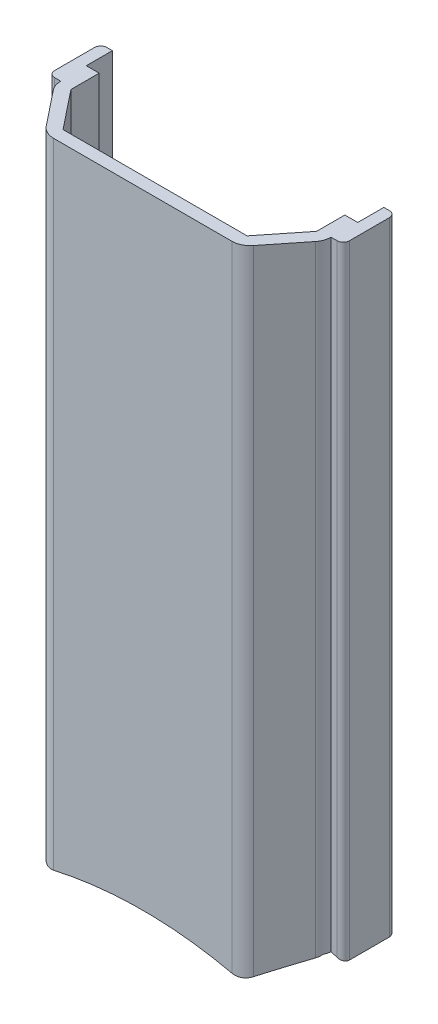
from build123d import *

# Parameters (mm, degrees)
EXTRUDE_1_DEPTH     = 58.89737674
EXTRUDE_START       = 38.399597665
EXTRUDE_2_DEPTH     = 38.399597665
EXTRUDE_3_REACH     = 66.893
SKETCH_3_W          = 44.2
SKETCH_3_H          = 3
EXTRUDE_4_REACH     = 66.893
SKETCH_4_W          = 44.2
SKETCH_4_H          = 3
CUT_EXTRUDE_START   = -77.29697691
CUT_EXTRUDE_1_DEPTH = 77.29697691
SKETCH_6_W          = 10.588620777
SKETCH_6_H          = 6.5
CUT_EXTRUDE_2_DEPTH = 3
EXTRUDE_START_2     = 15
EXTRUDE_5_DEPTH     = 15


with BuildPart() as part:
    # 草图1 → 凸台-拉伸1 (new body)
    with BuildSketch(Plane(origin=(0, 0, 0), x_dir=(1, 0, 0), z_dir=(0, 1, 0))):
        with BuildLine():
            Line((21.346642729, -10.719560241), (16.852020459, -16.362765964))
            ThreePointArc((16.852020459, -16.362765964), (15.807857901, -17.196247295), (14.505374257, -17.493741725))
            Line((14.505374257, -17.493741725), (-14.505381202, -17.493741725))
            ThreePointArc((-14.505381202, -17.493741725), (-15.807864846, -17.196247295), (-16.852027404, -16.362765964))
            Line((-16.852027404, -16.362765964), (-21.346649674, -10.719560241))
            ThreePointArc((-21.346649674, -10.719560241), (-21.831958504, -9.840501001), (-22.000003473, -8.850536003))
            Line((-22.000003473, -8.850536003), (-23.000003473, -8.850536003))
            ThreePointArc((-23.000003473, -8.850536003), (-23.707110254, -8.557642784), (-24.000003473, -7.850536003))
            Line((-24.000003473, -7.850536003), (-24.000003473, -1.349569462))
            ThreePointArc((-24.000003473, -1.349569462), (-23.707110254, -0.642462681), (-23.000003473, -0.349569462))
            Line((-23.000003473, -0.349569462), (-22.100003473, -0.349569462))
            Line((-22.100003473, -0.349569462), (-22.100003473, -4.600052733))
            Line((-22.100003473, -4.600052733), (-22.000003473, -4.600052733))
            Line((-22.000003473, -4.600052733), (-20.000003473, -4.600052733))
            Line((-20.000003473, -4.600052733), (-20.000003473, -9.200105465))
            Line((-20.000003473, -9.200105465), (-14.987335304, -15.493741725))
            Line((-14.987335304, -15.493741725), (14.987328359, -15.493741725))
            Line((14.987328359, -15.493741725), (19.999996527, -9.200105465))
            Line((19.999996527, -9.200105465), (19.999996527, -4.600052733))
            Line((19.999996527, -4.600052733), (21.999996527, -4.600052733))
            Line((21.999996527, -4.600052733), (22.099996527, -4.600052733))
            Line((22.099996527, -4.600052733), (22.099996527, -0.349569462))
            Line((22.099996527, -0.349569462), (22.999996527, -0.349569462))
            ThreePointArc((22.999996527, -0.349569462), (23.707103309, -0.642462681), (23.999996527, -1.349569462))
            Line((23.999996527, -1.349569462), (23.999996527, -7.850536003))
            ThreePointArc((23.999996527, -7.850536003), (23.707103309, -8.557642784), (22.999996527, -8.850536003))
            Line((22.999996527, -8.850536003), (21.999996527, -8.850536003))
            ThreePointArc((21.999996527, -8.850536003), (21.831951559, -9.840501001), (21.346642729, -10.719560241))
        make_face()
    extrude(amount=EXTRUDE_1_DEPTH)

    # 草图2 → 凸台-拉伸2 (add)
    with BuildSketch(Plane.XZ.offset(EXTRUDE_START)):
        with BuildLine():
            Line((22.999996527, 8.850536003), (21.999996527, 8.850536003))
            ThreePointArc((21.999996527, 8.850536003), (21.831951559, 9.840501001), (21.346642729, 10.719560241))
            Line((21.346642729, 10.719560241), (16.852020459, 16.362765964))
            ThreePointArc((16.852020459, 16.362765964), (15.807857901, 17.196247295), (14.505374257, 17.493741725))
            Line((14.505374257, 17.493741725), (-14.505381202, 17.493741725))
            ThreePointArc((-14.505381202, 17.493741725), (-15.807864846, 17.196247295), (-16.852027404, 16.362765964))
            Line((-16.852027404, 16.362765964), (-21.346649674, 10.719560241))
            ThreePointArc((-21.346649674, 10.719560241), (-21.831958504, 9.840501001), (-22.000003473, 8.850536003))
            Line((-22.000003473, 8.850536003), (-23.000003473, 8.850536003))
            ThreePointArc((-23.000003473, 8.850536003), (-23.707110254, 8.557642784), (-24.000003473, 7.850536003))
            Line((-24.000003473, 7.850536003), (-24.000003473, 1.349569462))
            ThreePointArc((-24.000003473, 1.349569462), (-23.707110254, 0.642462681), (-23.000003473, 0.349569462))
            Line((-23.000003473, 0.349569462), (-22.100003473, 0.349569462))
            Line((-22.100003473, 0.349569462), (-22.100003473, 4.600052733))
            Line((-22.100003473, 4.600052733), (-20.000003473, 4.600052733))
            Line((-20.000003473, 4.600052733), (-20.000003473, 9.200105465))
            Line((-20.000003473, 9.200105465), (-14.987335304, 15.493741725))
            Line((-14.987335304, 15.493741725), (14.987328359, 15.493741725))
            Line((14.987328359, 15.493741725), (19.999996527, 9.200105465))
            Line((19.999996527, 9.200105465), (19.999996527, 4.600052733))
            Line((19.999996527, 4.600052733), (22.099996527, 4.600052733))
            Line((22.099996527, 4.600052733), (22.099996527, 0.349569462))
            Line((22.099996527, 0.349569462), (22.999996527, 0.349569462))
            ThreePointArc((22.999996527, 0.349569462), (23.707103309, 0.642462681), (23.999996527, 1.349569462))
            Line((23.999996527, 1.349569462), (23.999996527, 7.850536003))
            ThreePointArc((23.999996527, 7.850536003), (23.707103309, 8.557642784), (22.999996527, 8.850536003))
        make_face()
    extrude(amount=-EXTRUDE_2_DEPTH)

    # 凸台-拉伸3: up to this face of the body (flat: up to its plane)
    extrude_3_end = Plane(part.part.faces().sort_by_distance((-3.473e-06, 10.248889538, 17.493741725))[0])
    # 草图3 → 凸台-拉伸3 (add, up to the picked face)
    with BuildSketch(Plane(origin=(0, 0, 4.600052733), x_dir=(-1, 0, 0), z_dir=(0, 0, -1)), mode=Mode.PRIVATE) as extrude_3_sk1:
        with Locations((3.473e-06, -36.899597665)):
            Rectangle(SKETCH_3_W, SKETCH_3_H)
    extrude_3_tool1 = split(extrude(extrude_3_sk1.sketch, amount=-EXTRUDE_3_REACH, mode=Mode.PRIVATE), bisect_by=extrude_3_end, keep=Keep.BOTH, mode=Mode.PRIVATE)
    add(extrude_3_tool1.solids().sort_by(Axis((-3e-06, -36.899598, 4.600053), (0, 0, 1)))[0])

    # 凸台-拉伸4: up to this face of the body (flat: up to its plane)
    extrude_4_end = Plane(part.part.faces().sort_by_distance((-3.473e-06, 9.499837909, 17.493741725))[0])
    # 草图4 → 凸台-拉伸4 (add, up to the picked face)
    with BuildSketch(Plane(origin=(0, 0, 4.600052733), x_dir=(-1, 0, 0), z_dir=(0, 0, -1)), mode=Mode.PRIVATE) as extrude_4_sk1:
        with Locations((3.473e-06, 37.397379245)):
            Rectangle(SKETCH_4_W, SKETCH_4_H)
    extrude_4_tool1 = split(extrude(extrude_4_sk1.sketch, amount=-EXTRUDE_4_REACH, mode=Mode.PRIVATE), bisect_by=extrude_4_end, keep=Keep.BOTH, mode=Mode.PRIVATE)
    add(extrude_4_tool1.solids().sort_by(Axis((-3e-06, 37.397379, 4.600053), (0, 0, 1)))[0])

    # 草图5 → 切除-拉伸1 (cut)
    with BuildSketch(Plane(origin=(0, 38.897379245, 0), x_dir=(1, 0, 0), z_dir=(0, 1, 0)).offset(CUT_EXTRUDE_START)):
        with BuildLine():
            Line((-22.100003473, -8.850536003), (-22.100003473, -17.493741725))
            Line((-22.100003473, -17.493741725), (-14.505381202, -17.493741725))
            ThreePointArc((-14.505381202, -17.493741725), (-15.807864846, -17.196247295), (-16.852027404, -16.362765964))
            Line((-16.852027404, -16.362765964), (-21.346649674, -10.719560241))
            ThreePointArc((-21.346649674, -10.719560241), (-21.831958504, -9.840501001), (-22.000003473, -8.850536003))
            Line((-22.000003473, -8.850536003), (-22.100003473, -8.850536003))
        make_face()
        with BuildLine():
            Line((14.505374257, -17.493741725), (22.099996527, -17.493741725))
            Line((22.099996527, -17.493741725), (22.099996527, -8.850536003))
            Line((22.099996527, -8.850536003), (21.999996527, -8.850536003))
            ThreePointArc((21.999996527, -8.850536003), (21.831951559, -9.840501001), (21.346642729, -10.719560241))
            Line((21.346642729, -10.719560241), (16.852020459, -16.362765964))
            ThreePointArc((16.852020459, -16.362765964), (15.807857901, -17.196247295), (14.505374257, -17.493741725))
        make_face()
    extrude(amount=CUT_EXTRUDE_1_DEPTH, mode=Mode.SUBTRACT)

    # 草图6 → 切除-拉伸2 (cut)
    with BuildSketch(Plane(origin=(0, 38.897379245, 0), x_dir=(1, 0, 0), z_dir=(0, 1, 0))):
        with Locations((-3.3e-06, -10.750052671)):
            Rectangle(SKETCH_6_W, SKETCH_6_H)
    extrude(amount=-CUT_EXTRUDE_2_DEPTH, mode=Mode.SUBTRACT)

    # 草图7 → 凸台-拉伸5 (add)
    with BuildSketch(Plane(origin=(0, -38.399597665, 0), x_dir=(-1, 0, 0), z_dir=(0, -1, 0)).offset(EXTRUDE_START_2)):
        with BuildLine():
            Line((20.000003473, -4.600052733), (20.000003473, -9.200105465))
            Line((20.000003473, -9.200105465), (14.987335304, -15.493741725))
            Line((14.987335304, -15.493741725), (-14.987328359, -15.493741725))
            Line((-14.987328359, -15.493741725), (-19.999996527, -9.200105465))
            Line((-19.999996527, -9.200105465), (-19.999996527, -4.600052733))
            Line((-19.999996527, -4.600052733), (-21.999996527, -4.600052733))
            Line((-21.999996527, -4.600052733), (-22.099996527, -4.600052733))
            Line((-22.099996527, -4.600052733), (-22.099996527, -0.349569462))
            Line((-22.099996527, -0.349569462), (-22.999996527, -0.349569462))
            ThreePointArc((-22.999996527, -0.349569462), (-23.707103309, -0.642462681), (-23.999996527, -1.349569462))
            Line((-23.999996527, -1.349569462), (-23.999996527, -7.850536003))
            ThreePointArc((-23.999996527, -7.850536003), (-23.707103309, -8.557642784), (-22.999996527, -8.850536003))
            Line((-22.999996527, -8.850536003), (-21.999996527, -8.850536003))
            ThreePointArc((-21.999996527, -8.850536003), (-21.831951559, -9.840501001), (-21.346642729, -10.719560241))
            Line((-21.346642729, -10.719560241), (-16.852020459, -16.362765964))
            ThreePointArc((-16.852020459, -16.362765964), (-15.807857901, -17.196247295), (-14.505374257, -17.493741725))
            Line((-14.505374257, -17.493741725), (14.505381202, -17.493741725))
            ThreePointArc((14.505381202, -17.493741725), (15.807864846, -17.196247295), (16.852027404, -16.362765964))
            Line((16.852027404, -16.362765964), (21.346649674, -10.719560241))
            ThreePointArc((21.346649674, -10.719560241), (21.831958504, -9.840501001), (22.000003473, -8.850536003))
            Line((22.000003473, -8.850536003), (23.000003473, -8.850536003))
            ThreePointArc((23.000003473, -8.850536003), (23.707110254, -8.557642784), (24.000003473, -7.850536003))
            Line((24.000003473, -7.850536003), (24.000003473, -1.349569462))
            ThreePointArc((24.000003473, -1.349569462), (23.707110254, -0.642462681), (23.000003473, -0.349569462))
            Line((23.000003473, -0.349569462), (22.100003473, -0.349569462))
            Line((22.100003473, -0.349569462), (22.100003473, -4.600052733))
            Line((22.100003473, -4.600052733), (22.000003473, -4.600052733))
            Line((22.000003473, -4.600052733), (20.000003473, -4.600052733))
        make_face()
    extrude(amount=-EXTRUDE_5_DEPTH)

    # 草图8 → 切除-旋转1 (revolve, cut)
    with BuildSketch(Plane(origin=(0, 0, 0), x_dir=(0, 0, -1), z_dir=(1, 0, 0))):
        Polygon((-9.89924439, -38.299597665), (-20.291549236, -44.299597665), (-20.291549236, -55.801852499), (11.09144377, -55.801852499), (11.09144377, -44.299597665), (0.699138925, -38.299597665), align=None)
    revolve(axis=Axis((0, -108.399597665, 9.89924439), (0, 0, -1)), mode=Mode.SUBTRACT)


solid = part.part
